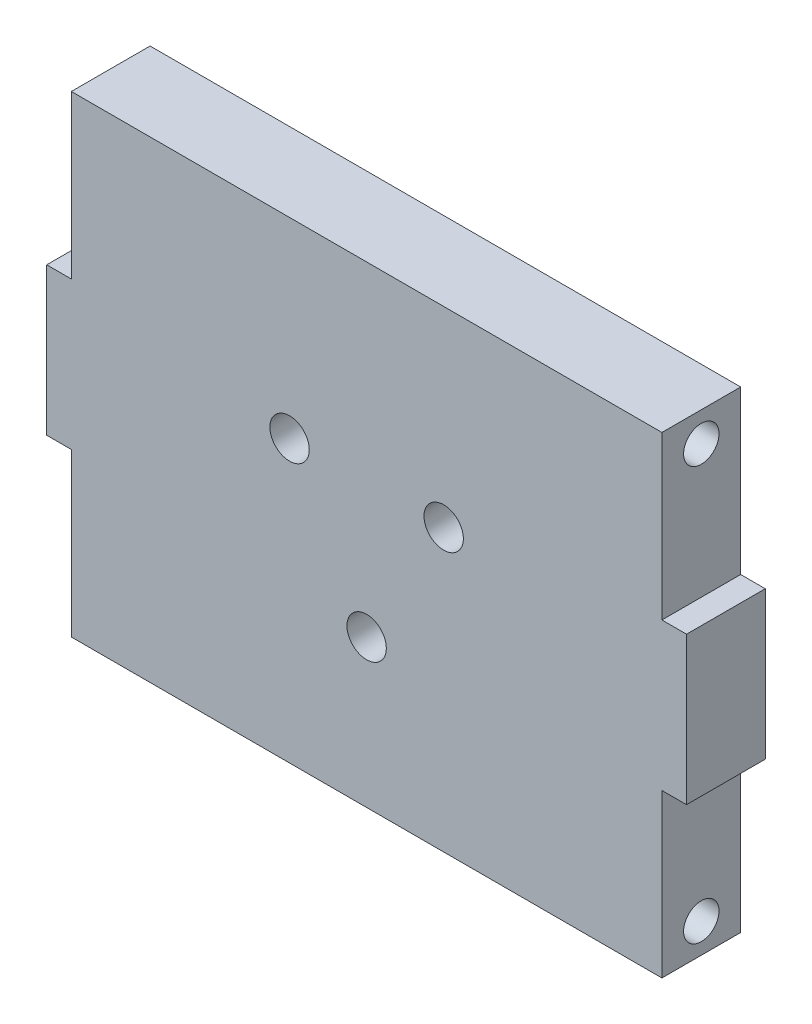
from build123d import *

# Parameters (mm, degrees)
SKETCH_1_W               = 60
SKETCH_1_H               = 48
EXTRUDE_1_DEPTH          = 8
SKETCH_2_W               = 65
SKETCH_2_H               = 15
EXTRUDE_2_DEPTH          = 8
SKETCH_3_R               = 2
CUT_EXTRUDE_1_DEPTH      = 8
PATTERN_CIRCULAR_1_COUNT = 3
SKETCH_4_R               = 1.8
CUT_EXTRUDE_2_DEPTH      = 3
MIRROR_2_COPY_1_SKETCH_R = 1.8
MIRROR_2_COPY_1_DEPTH    = 3


with BuildPart() as part:
    # 草图1 → 凸台-拉伸1 (new body)
    with BuildSketch(Plane.XY):
        Rectangle(SKETCH_1_W, SKETCH_1_H)
    extrude(amount=EXTRUDE_1_DEPTH)

    # 草图2 → 凸台-拉伸2 (add)
    with BuildSketch(Plane.XY.offset(8)):
        Rectangle(SKETCH_2_W, SKETCH_2_H)
    extrude(amount=-EXTRUDE_2_DEPTH)

    # 草图3 → 切除-拉伸1 (cut)
    with BuildSketch(Plane.XY.offset(8)):
        with Locations((0, -9)):
            Circle(SKETCH_3_R)
    cut_extrude_1 = extrude(amount=-CUT_EXTRUDE_1_DEPTH, mode=Mode.SUBTRACT)

    # 阵列(圆周)1: 切除-拉伸1 ×3 about axis
    pattern_circular_1_axis = Axis((0, 0.038436665, 0), (0, 0, 1))
    for i in range(1, PATTERN_CIRCULAR_1_COUNT):
        add(cut_extrude_1.rotate(pattern_circular_1_axis, i * 360 / PATTERN_CIRCULAR_1_COUNT), mode=Mode.SUBTRACT)

    # 草图4 → 切除-拉伸2 (cut)
    with BuildSketch(Plane(origin=(30, 0, 0), x_dir=(0, 0, -1), z_dir=(1, 0, 0))):
        with Locations(Location((-4, 21, 0), (0, 0, 90))):
            Circle(SKETCH_4_R)
    cut_extrude_2 = extrude(amount=-CUT_EXTRUDE_2_DEPTH, mode=Mode.SUBTRACT)

    # 镜向1: 切除-拉伸2 across plane
    add(cut_extrude_2.mirror(Plane.ZX), mode=Mode.SUBTRACT)

    # 镜向2: 切除-拉伸2 across plane
    add(cut_extrude_2.mirror(Plane(origin=(0, 0, 0), x_dir=(0, 0, 1), z_dir=(1, 0, 0))), mode=Mode.SUBTRACT)

    # 镜向2 copy 1 sketch → 镜向2 copy 1 (cut)
    with BuildSketch(Plane(origin=(-30, 0, 0), x_dir=(0, 0, -1), z_dir=(-1, 0, 0))):
        with Locations(Location((-4, 21, 0), (0, 0, 90))):
            Circle(MIRROR_2_COPY_1_SKETCH_R)
    extrude(amount=-MIRROR_2_COPY_1_DEPTH, mode=Mode.SUBTRACT)


solid = part.part
